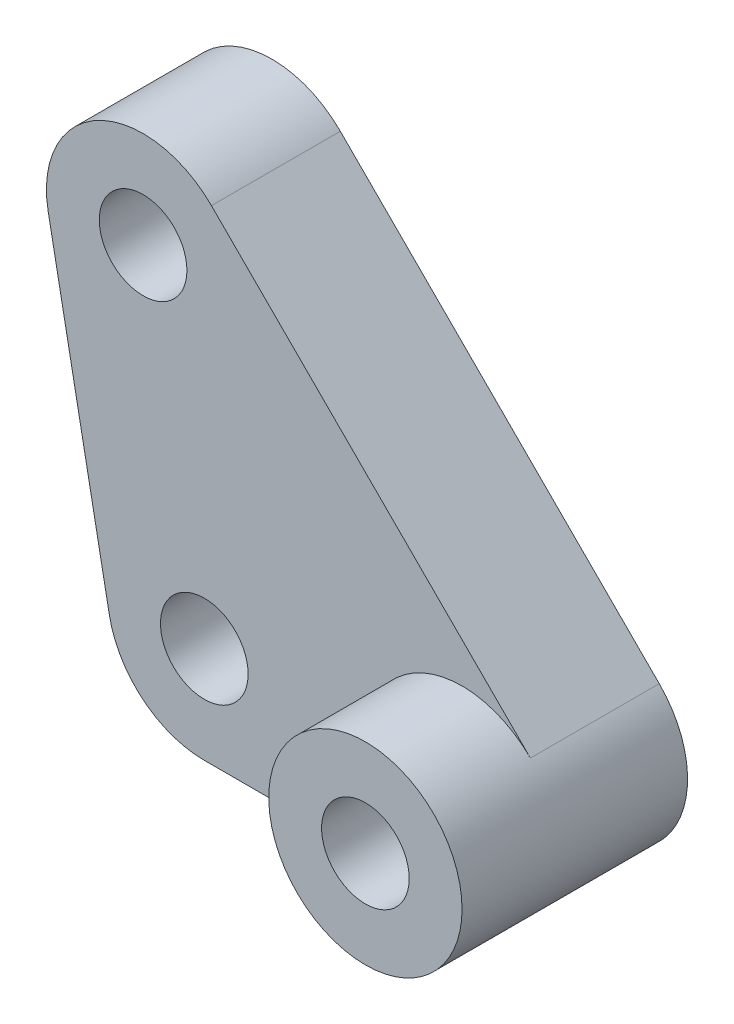
from build123d import *
from build123d.topology import SkipClean

# Parameters (mm, degrees)
SKETCH1_R           = 2.159
BOSS_EXTRUDE1_DEPTH = 3.175
SKETCH3_R           = 4.7625
SKETCH3_R_2         = 2.159
BOSS_EXTRUDE2_DEPTH = 4.7625


with BuildPart() as part:
    # Sketch1 → Boss-Extrude1 (new, symmetric)
    with BuildSketch(Plane.XY):
        with BuildLine():
            Line((0, -4.7625), (-12.7, -4.7625))
            ThreePointArc((-12.7, -4.7625), (-15.733752874, -3.67120549), (-17.377178039, -0.897447401))
            Line((-17.377178039, -0.897447401), (-20.392626251, 14.818000811))
            ThreePointArc((-20.392626251, 14.818000811), (-17.946232861, 19.923179917), (-12.347852166, 19.083044257))
            Line((-12.347852166, 19.083044257), (3.367596045, 3.367596045))
            ThreePointArc((3.367596045, 3.367596045), (4.399976274, -1.822529847), (0, -4.7625))
        make_face()
        with Locations((-12.7, 0)):
            Circle(SKETCH1_R, mode=Mode.SUBTRACT)
        with Locations((-15.715448212, 15.715448212)):
            Circle(SKETCH1_R, mode=Mode.SUBTRACT)
        Circle(SKETCH1_R, mode=Mode.SUBTRACT)
    extrude(amount=BOSS_EXTRUDE1_DEPTH, both=True)

    # Sketch3 → Boss-Extrude2 (add, symmetric)
    with SkipClean():  # the faces are left unmerged after this step: merging them gives an invalid solid
        with BuildSketch(Plane.XY.offset(3.175)):
            with Locations(Location((0, 0, 0), (0, 0, 270))):
                Circle(SKETCH3_R)
            Circle(SKETCH3_R_2, mode=Mode.SUBTRACT)
        extrude(amount=BOSS_EXTRUDE2_DEPTH, both=True)


solid = part.part
